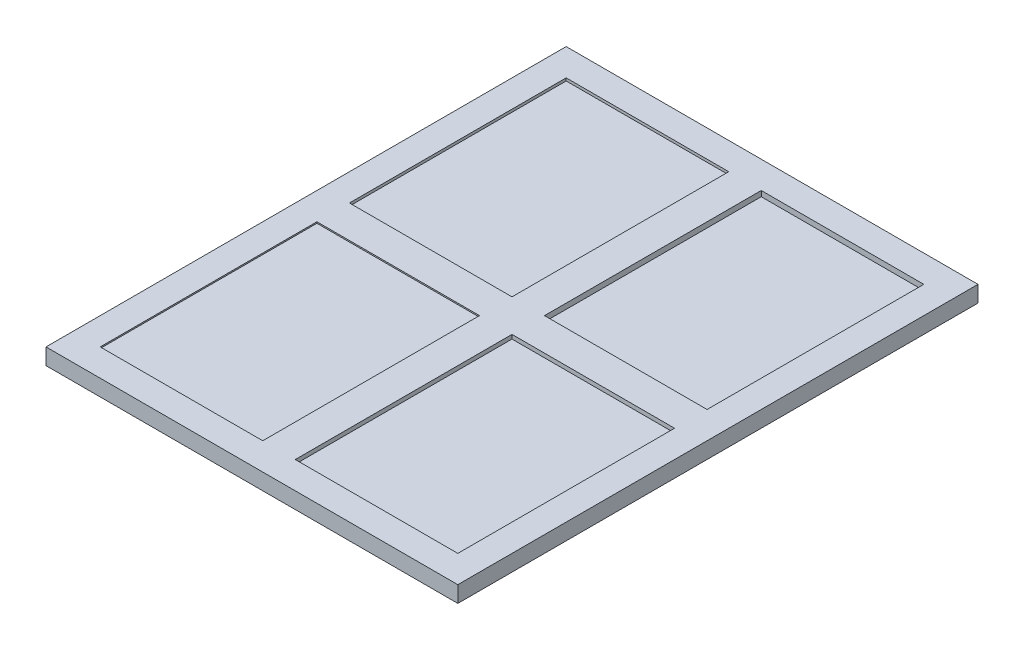
from build123d import *

# Parameters (mm, degrees)
SKETCH1_W           = 76
SKETCH1_H           = 96
SKETCH1_W_2         = 30
SKETCH1_H_2         = 40
BOSS_EXTRUDE1_DEPTH = 0.25
SKETCH2_W           = 76
SKETCH2_H           = 96
BOSS_EXTRUDE2_DEPTH = 4
SKETCH3_W           = 30
SKETCH3_H           = 40
CUT_EXTRUDE1_DEPTH  = 0.25
SKETCH4_W           = 30
SKETCH4_H           = 40
CUT_EXTRUDE2_DEPTH  = 0.5
SKETCH5_W           = 30
SKETCH5_H           = 40
CUT_EXTRUDE3_DEPTH  = 0.75
SKETCH6_W           = 83.006350466
SKETCH6_H           = 7.589152043
CUT_EXTRUDE4_DEPTH  = 107.75


with BuildPart() as part:
    # Sketch1 → Boss-Extrude1 (new body)
    with BuildSketch(Plane(origin=(0, 0, 0), x_dir=(1, 0, 0), z_dir=(0, 1, 0))):
        Rectangle(SKETCH1_W, SKETCH1_H)
        with Locations((-18, 23)):
            Rectangle(SKETCH1_W_2, SKETCH1_H_2, mode=Mode.SUBTRACT)
        with Locations((18, 23)):
            Rectangle(SKETCH1_W_2, SKETCH1_H_2, mode=Mode.SUBTRACT)
        with Locations((18, -23)):
            Rectangle(SKETCH1_W_2, SKETCH1_H_2, mode=Mode.SUBTRACT)
        with Locations((-18, -23)):
            Rectangle(SKETCH1_W_2, SKETCH1_H_2, mode=Mode.SUBTRACT)
    extrude(amount=BOSS_EXTRUDE1_DEPTH)

    # Sketch2 → Boss-Extrude2 (add)
    with BuildSketch(Plane.XZ):
        Rectangle(SKETCH2_W, SKETCH2_H)
    extrude(amount=BOSS_EXTRUDE2_DEPTH)

    # Sketch3 → Cut-Extrude1 (cut)
    with BuildSketch(Plane(origin=(0, 0, 0), x_dir=(1, 0, 0), z_dir=(0, 1, 0))):
        with Locations((-18, 23)):
            Rectangle(SKETCH3_W, SKETCH3_H)
    extrude(amount=-CUT_EXTRUDE1_DEPTH, mode=Mode.SUBTRACT)

    # Sketch4 → Cut-Extrude2 (cut)
    with BuildSketch(Plane(origin=(0, 0, 0), x_dir=(1, 0, 0), z_dir=(0, 1, 0))):
        with Locations((18, -23)):
            Rectangle(SKETCH4_W, SKETCH4_H)
    extrude(amount=-CUT_EXTRUDE2_DEPTH, mode=Mode.SUBTRACT)

    # Sketch5 → Cut-Extrude3 (cut)
    with BuildSketch(Plane(origin=(0, 0, 0), x_dir=(1, 0, 0), z_dir=(0, 1, 0))):
        with Locations((18, 23)):
            Rectangle(SKETCH5_W, SKETCH5_H)
    extrude(amount=-CUT_EXTRUDE3_DEPTH, mode=Mode.SUBTRACT)

    # Sketch6 → Cut-Extrude4 (cut)
    with BuildSketch(Plane.XY.offset(48)):
        with Locations((-0.355741502, -6.544576022)):
            Rectangle(SKETCH6_W, SKETCH6_H)
    extrude(amount=-CUT_EXTRUDE4_DEPTH, mode=Mode.SUBTRACT)


solid = part.part
